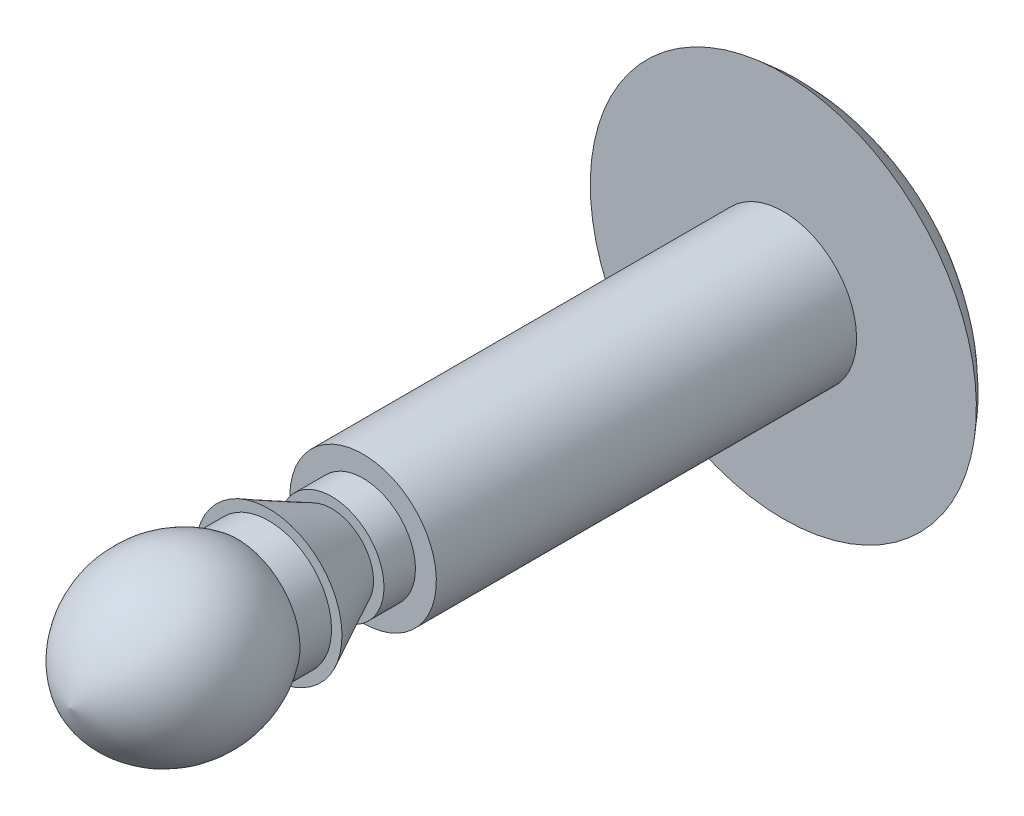
from build123d import *

# Parameters (mm, degrees)
SKETCH3_R          = 10.452405385
CUT_EXTRUDE1_DEPTH = 20.505116436


with BuildPart() as part:
    # Sketch2 → Revolve1 (revolve)
    with BuildSketch(Plane(origin=(0, 0, 0), x_dir=(0, 0, -1), z_dir=(1, 0, 0)), mode=Mode.PRIVATE) as revolve1_sk:
        with BuildLine():
            Line((-10.0076, 1.7446625), (-10.0076, 1.2461875))
            Line((-10.0076, 1.2461875), (-10.7569, 1.2461875))
            Line((-10.7569, 1.2461875), (-10.7569, 0.99695))
            Line((-10.7569, 0.99695), (-12.2555, 1.7446625))
            Line((-12.2555, 1.7446625), (-12.2555, 1.495425))
            Line((-12.2555, 1.495425), (-13.0048, 1.495425))
            ThreePointArc((-13.0048, 1.495425), (-15.4054584, 1.832401568), (-16.9926, 0))
            Line((-16.9926, 0), (-9.666659115, 0))
            Line((-9.666659115, 0), (18.3896, 0))
            Line((18.3896, 0), (17.891125, 0.99695))
            Line((17.891125, 0.99695), (1.397, 0.99695))
            Line((1.397, 0.99695), (1.016, 0.99695))
            Line((1.016, 0.99695), (1.016, 1.099038642))
            ThreePointArc((1.016, 1.099038642), (1.294911358, 1.37795), (1.397, 1.75895))
            ThreePointArc((1.397, 1.75895), (1.028829656, 3.340753354), (0, 4.5974))
            Line((0, 4.5974), (0, 1.7446625))
            Line((0, 1.7446625), (-10.0076, 1.7446625))
        make_face()
    revolve(revolve1_sk.sketch.rotate(Axis((0, 0, 9.666659115), (0, 0, -1)), 180), axis=Axis((0, 0, 9.666659115), (0, 0, -1)))

    # Sketch3 → Cut-Extrude1 (cut, through all)
    with BuildSketch(Plane.XY.offset(-1.397)):
        Circle(SKETCH3_R)
    extrude(amount=-CUT_EXTRUDE1_DEPTH, mode=Mode.SUBTRACT)


solid = part.part
